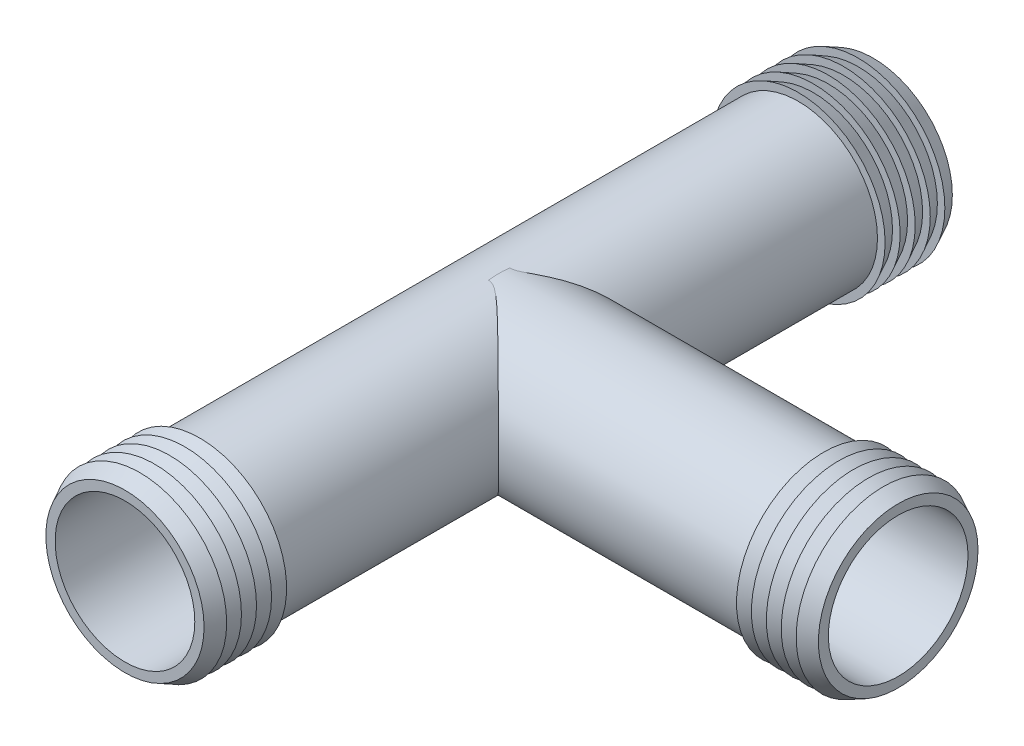
from build123d import *

# Parameters (mm, degrees)
BOSS_EXTRUDE1_DEPTH      = 75
BOSS_EXTRUDE1_DEPTH_BACK = 75
SKETCH1_R                = 15.858479127
SKETCH1_R_2              = 14
SKETCH12_R               = 16
SKETCH12_R_2             = 14
BOSS_EXTRUDE2_DEPTH      = 80
SKETCH13_R               = 14
CUT_EXTRUDE1_DEPTH       = 81
CUT_EXTRUDE2_DEPTH       = 90
CUT_EXTRUDE2_DEPTH_BACK  = 95
SKETCH15_R               = 14


with BuildPart() as part:
    # Sketch1 → Boss-Extrude1 (new, two sides: drawn at the far end of the back side and taken through both)
    with BuildSketch(Plane.XY.offset(-BOSS_EXTRUDE1_DEPTH_BACK)):
        Circle(SKETCH1_R)
        Circle(SKETCH1_R_2, mode=Mode.SUBTRACT)
    extrude(amount=BOSS_EXTRUDE1_DEPTH + BOSS_EXTRUDE1_DEPTH_BACK)

    # Sketch2 → Revolve1 (revolve)
    with BuildSketch(Plane(origin=(0, 0, 0), x_dir=(0, 0, -1), z_dir=(1, 0, 0)), mode=Mode.PRIVATE) as revolve1_sk:
        Polygon((75, 15.858479127), (72, 15.858479127), (72, 17.358479127), align=None)
    revolve(revolve1_sk.sketch.rotate(Axis((0, 0, 0), (0, 0, -1)), 90), axis=Axis((0, 0, 0), (0, 0, -1)))

    # Sketch3 → Revolve2 (revolve)
    with BuildSketch(Plane(origin=(0, 0, 0), x_dir=(0, 0, -1), z_dir=(1, 0, 0)), mode=Mode.PRIVATE) as revolve2_sk:
        Polygon((72, 15.858479127), (69.040504624, 15.858479127), (69.040504624, 17.393237669), align=None)
    revolve(revolve2_sk.sketch.rotate(Axis((0, 0, 0), (0, 0, -1)), 90), axis=Axis((0, 0, 0), (0, 0, -1)))

    # Sketch4 → Revolve3 (revolve)
    with BuildSketch(Plane(origin=(0, 0, 0), x_dir=(0, 0, -1), z_dir=(1, 0, 0)), mode=Mode.PRIVATE) as revolve3_sk:
        Polygon((69.040504624, 15.858479127), (66.023310335, 15.858479127), (66.023310335, 17.393237669), align=None)
    revolve(revolve3_sk.sketch.rotate(Axis((0, 0, 0), (0, 0, -1)), 90), axis=Axis((0, 0, 0), (0, 0, -1)))

    # Sketch5 → Revolve4 (revolve)
    with BuildSketch(Plane(origin=(0, 0, 0), x_dir=(0, 0, -1), z_dir=(1, 0, 0)), mode=Mode.PRIVATE) as revolve4_sk:
        Polygon((66.023310335, 15.858479127), (63.006116045, 15.858479127), (63.006116045, 17.393237669), align=None)
    revolve(revolve4_sk.sketch.rotate(Axis((0, 0, 0), (0, 0, -1)), 90), axis=Axis((0, 0, 0), (0, 0, -1)))

    # Sketch6 → Revolve5 (revolve)
    with BuildSketch(Plane(origin=(0, 0, 0), x_dir=(0, 0, -1), z_dir=(1, 0, 0)), mode=Mode.PRIVATE) as revolve5_sk:
        Polygon((63.006116045, 15.858479127), (59.988921756, 15.858479127), (59.988921756, 17.393237669), align=None)
    revolve(revolve5_sk.sketch.rotate(Axis((0, 0, 0), (0, 0, -1)), 90), axis=Axis((0, 0, 0), (0, 0, -1)))

    # Sketch7 → Revolve6 (revolve)
    with BuildSketch(Plane(origin=(0, 0, 0), x_dir=(0, 0, -1), z_dir=(1, 0, 0)), mode=Mode.PRIVATE) as revolve6_sk:
        Polygon((-75, 15.858479127), (-72, 15.858479127), (-72, 17.393237669), align=None)
    revolve(revolve6_sk.sketch.rotate(Axis((0, 0, 0), (0, 0, -1)), 90), axis=Axis((0, 0, 0), (0, 0, -1)))

    # Sketch8 → Revolve7 (revolve)
    with BuildSketch(Plane(origin=(0, 0, 0), x_dir=(0, 0, -1), z_dir=(1, 0, 0)), mode=Mode.PRIVATE) as revolve7_sk:
        Polygon((-72, 15.858479127), (-69.040504624, 15.858479127), (-69.040504624, 17.393237669), align=None)
    revolve(revolve7_sk.sketch.rotate(Axis((0, 0, 0), (0, 0, -1)), 90), axis=Axis((0, 0, 0), (0, 0, -1)))

    # Sketch9 → Revolve8 (revolve)
    with BuildSketch(Plane(origin=(0, 0, 0), x_dir=(0, 0, -1), z_dir=(1, 0, 0)), mode=Mode.PRIVATE) as revolve8_sk:
        Polygon((-69.040504624, 15.858479127), (-66.023310335, 15.858479127), (-66.023310335, 17.393237669), align=None)
    revolve(revolve8_sk.sketch.rotate(Axis((0, 0, 0), (0, 0, -1)), 90), axis=Axis((0, 0, 0), (0, 0, -1)))

    # Sketch10 → Revolve9 (revolve)
    with BuildSketch(Plane(origin=(0, 0, 0), x_dir=(0, 0, -1), z_dir=(1, 0, 0)), mode=Mode.PRIVATE) as revolve9_sk:
        Polygon((-66.023310335, 15.858479127), (-63.006116045, 15.858479127), (-63.006116045, 17.393237669), align=None)
    revolve(revolve9_sk.sketch.rotate(Axis((0, 0, 0), (0, 0, -1)), 90), axis=Axis((0, 0, 0), (0, 0, -1)))

    # Sketch11 → Revolve10 (revolve)
    with BuildSketch(Plane(origin=(0, 0, 0), x_dir=(0, 0, -1), z_dir=(1, 0, 0)), mode=Mode.PRIVATE) as revolve10_sk:
        Polygon((-63.006116045, 15.858479127), (-59.988921756, 15.858479127), (-59.988921756, 17.393237669), align=None)
    revolve(revolve10_sk.sketch.rotate(Axis((0, 0, 0), (0, 0, 1)), 270), axis=Axis((0, 0, 0), (0, 0, 1)))

    # Sketch12 → Boss-Extrude2 (add)
    with BuildSketch(Plane(origin=(0, 0, 0), x_dir=(0, 0, -1), z_dir=(1, 0, 0))):
        Circle(SKETCH12_R)
        Circle(SKETCH12_R_2, mode=Mode.SUBTRACT)
    extrude(amount=BOSS_EXTRUDE2_DEPTH)

    # Sketch13 → Cut-Extrude1 (cut)
    with BuildSketch(Plane(origin=(0, 0, 0), x_dir=(0, 0, -1), z_dir=(1, 0, 0))):
        with Locations(Location((0, 0, 0), (0, 0, 90))):
            Circle(SKETCH13_R)
    extrude(amount=CUT_EXTRUDE1_DEPTH, mode=Mode.SUBTRACT)

    # Sketch15 → Cut-Extrude2 (cut, two sides: drawn at the far end of the back side and taken through both)
    with BuildSketch(Plane.XY.offset(-CUT_EXTRUDE2_DEPTH_BACK)):
        Circle(SKETCH15_R)
    extrude(amount=CUT_EXTRUDE2_DEPTH + CUT_EXTRUDE2_DEPTH_BACK, mode=Mode.SUBTRACT)

    # Sketch16 → Revolve11 (revolve)
    with BuildSketch(Plane.XY, mode=Mode.PRIVATE) as revolve11_sk:
        Polygon((80, 16), (77.013377654, 16), (77.013377654, 17.472012137), align=None)
    revolve(revolve11_sk.sketch.rotate(Axis((0, 0, 0), (-1, 0, 0)), 90), axis=Axis((0, 0, 0), (-1, 0, 0)))

    # Sketch17 → Revolve12 (revolve)
    with BuildSketch(Plane.XY, mode=Mode.PRIVATE) as revolve12_sk:
        Polygon((77.013377654, 16), (74.024743999, 16), (74.024743999, 17.472012137), align=None)
    revolve(revolve12_sk.sketch.rotate(Axis((0, 0, 0), (-1, 0, 0)), 90), axis=Axis((0, 0, 0), (-1, 0, 0)))

    # Sketch18 → Revolve13 (revolve)
    with BuildSketch(Plane.XY, mode=Mode.PRIVATE) as revolve13_sk:
        Polygon((74.024743999, 16), (71.036110344, 16), (71.036110344, 17.472012137), align=None)
    revolve(revolve13_sk.sketch.rotate(Axis((0, 0, 0), (-1, 0, 0)), 90), axis=Axis((0, 0, 0), (-1, 0, 0)))

    # Sketch19 → Revolve14 (revolve)
    with BuildSketch(Plane.XY, mode=Mode.PRIVATE) as revolve14_sk:
        Polygon((71.036110344, 16), (68.047476689, 16), (68.047476689, 17.472012137), align=None)
    revolve(revolve14_sk.sketch.rotate(Axis((0, 0, 0), (-1, 0, 0)), 90), axis=Axis((0, 0, 0), (-1, 0, 0)))

    # Sketch20 → Revolve15 (revolve)
    with BuildSketch(Plane.XY, mode=Mode.PRIVATE) as revolve15_sk:
        Polygon((68.047476689, 16), (65.058843034, 16), (65.058843034, 17.472012137), align=None)
    revolve(revolve15_sk.sketch.rotate(Axis((0, 0, 0), (-1, 0, 0)), 90), axis=Axis((0, 0, 0), (-1, 0, 0)))


solid = part.part
